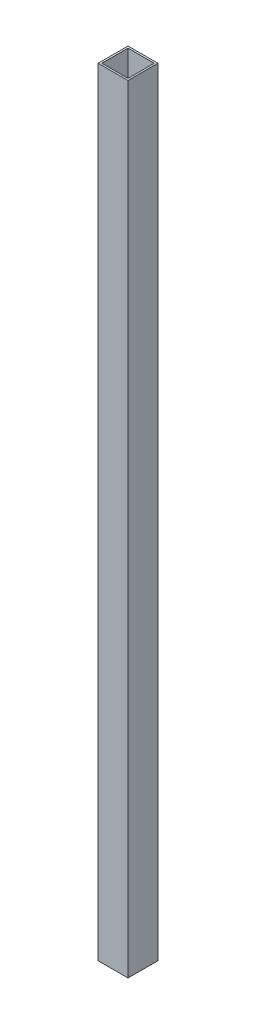
from build123d import *

# Parameters (mm, degrees)
SKETCH1_W           = 25.4
SKETCH1_H           = 25.4
SKETCH1_W_2         = 22.225
SKETCH1_H_2         = 22.225
BOSS_EXTRUDE1_DEPTH = 660.4


with BuildPart() as part:
    # Sketch1 → Boss-Extrude1 (new body)
    with BuildSketch(Plane(origin=(0, 0, 0), x_dir=(1, 0, 0), z_dir=(0, 1, 0))):
        Rectangle(SKETCH1_W, SKETCH1_H)
        Rectangle(SKETCH1_W_2, SKETCH1_H_2, mode=Mode.SUBTRACT)
    extrude(amount=BOSS_EXTRUDE1_DEPTH)


solid = part.part
